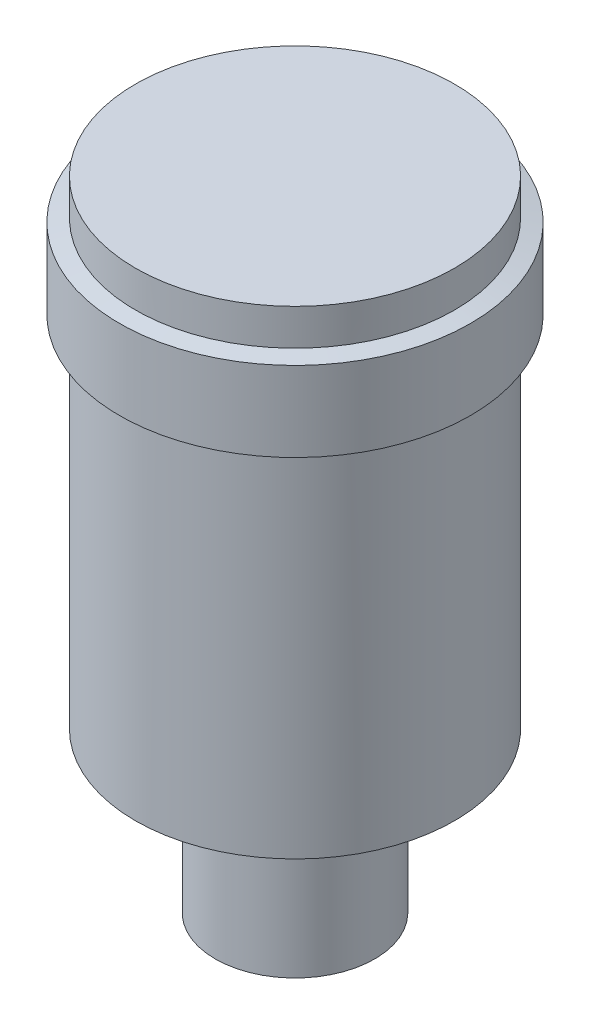
from build123d import *

# Parameters (mm, degrees)
SKETCH_1_R      = 1
EXTRUDE_1_DEPTH = 2
SKETCH_2_R      = 2
EXTRUDE_2_DEPTH = 6


with BuildPart() as part:
    # 草图1 → 凸台-拉伸1 (new body)
    with BuildSketch(Plane(origin=(0, 0, 0), x_dir=(1, 0, 0), z_dir=(0, 1, 0))):
        with Locations(Location((0, 0, 0), (0, 0, 270))):
            Circle(SKETCH_1_R)
    extrude(amount=EXTRUDE_1_DEPTH)

    # 草图2 → 凸台-拉伸2 (add)
    with BuildSketch(Plane(origin=(0, 2, 0), x_dir=(1, 0, 0), z_dir=(0, 1, 0))):
        with Locations(Location((0, 0, 0), (0, 0, 270))):
            Circle(SKETCH_2_R)
    extrude(amount=EXTRUDE_2_DEPTH)

    # 草图3 → 旋转1 (revolve)
    with BuildSketch(Plane.XY, mode=Mode.PRIVATE) as revolve_1_sk:
        Polygon((0, 8), (0, 6), (2.2, 6.5), (2.2, 7.5), align=None)
    revolve(revolve_1_sk.sketch.rotate(Axis((0, 8, 0), (0, -1, 0)), 180), axis=Axis((0, 8, 0), (0, -1, 0)))


solid = part.part
